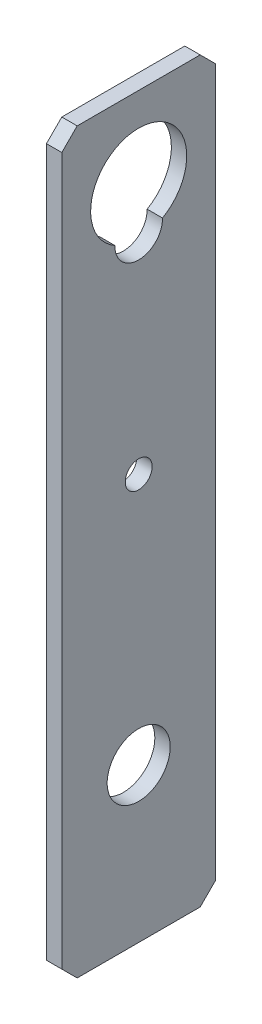
from build123d import *

# Parameters (mm, degrees)
SKETCH1_W           = 20
SKETCH1_H           = 96
BOSS_EXTRUDE2_DEPTH = 2
SKETCH3_R           = 1.75
SKETCH3_R_2         = 4.1
CUT_EXTRUDE1_DEPTH  = 50.071376586
CHAMFER1_SIZE       = 2


with BuildPart() as part:
    # Sketch1 → Boss-Extrude2 (new body)
    with BuildSketch(Plane(origin=(0, 0, 0), x_dir=(0, 0, -1), z_dir=(1, 0, 0))):
        Rectangle(SKETCH1_W, SKETCH1_H)
    extrude(amount=BOSS_EXTRUDE2_DEPTH)

    # Sketch3 → Cut-Extrude1 (cut, through all)
    with BuildSketch(Plane(origin=(2, 0, 0), x_dir=(0, 0, -1), z_dir=(1, 0, 0))):
        with Locations((0, 4.75)):
            Circle(SKETCH3_R)
        with Locations((0, -28)):
            Circle(SKETCH3_R_2)
        with BuildLine():
            ThreePointArc((3.099152102, 32.0725), (0, 43.75), (-3.099152102, 32.0725))
            ThreePointArc((-3.099152102, 32.0725), (0, 28.9), (3.099152102, 32.0725))
        make_face()
    extrude(amount=-CUT_EXTRUDE1_DEPTH, mode=Mode.SUBTRACT)

    # Chamfer1
    chamfer1_edges = [part.edges().sort_by_distance(p)[0] for p in [
        (1, -48, -10),
        (1, -48, 10),
        (1, 48, 10),
        (1, 48, -10),
    ]]
    chamfer(chamfer1_edges, length=CHAMFER1_SIZE)


solid = part.part
